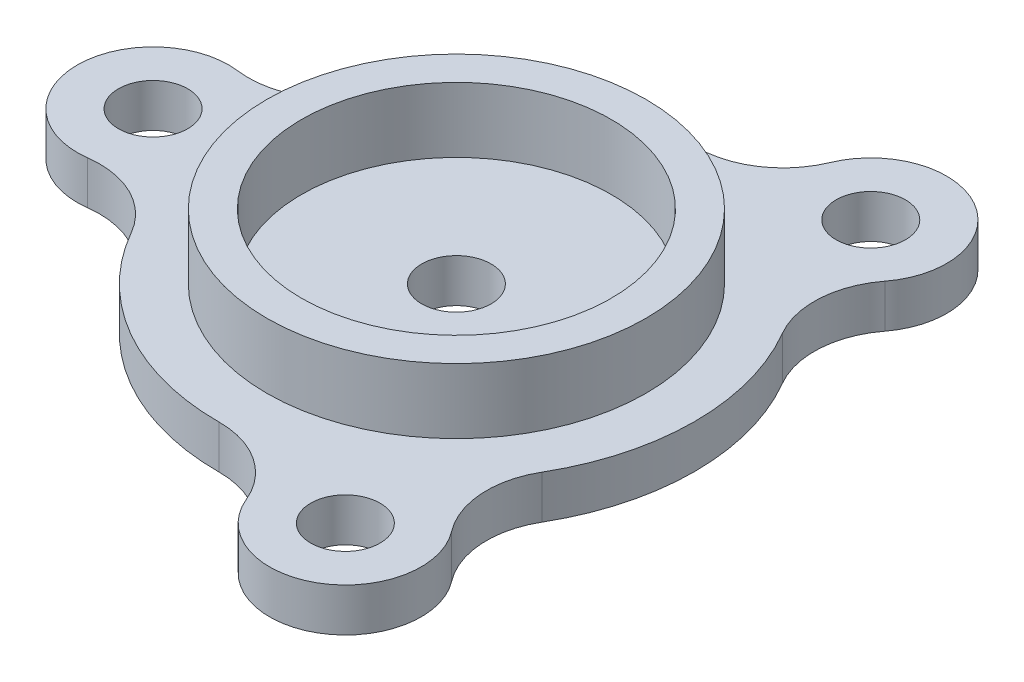
from build123d import *

# Parameters (mm, degrees)
SKETCH_1_R          = 11
EXTRUDE_1_DEPTH     = 2
EXTRUDE_START       = -2
SKETCH_2_R          = 1.6
EXTRUDE_2_DEPTH     = 2
CUT_EXTRUDE_1_REACH = 25.545
SKETCH_3_R          = 1.6
SKETCH_4_R          = 8.75
SKETCH_4_R_2        = 7.15
EXTRUDE_3_DEPTH     = 3


with BuildPart() as part:
    # 草图1 → 凸台-拉伸1 (new body)
    with BuildSketch(Plane(origin=(0, 0, 0), x_dir=(1, 0, 0), z_dir=(0, 1, 0))):
        with Locations(Location((0, 0, 0), (0, 0, 270))):
            Circle(SKETCH_1_R)
    extrude(amount=EXTRUDE_1_DEPTH)

    # 草图2 → 凸台-拉伸2 (add)
    # profile 1 of 3: a face of its own
    with BuildSketch(Plane(origin=(0, 2, 0), x_dir=(1, 0, 0), z_dir=(0, 1, 0)).offset(EXTRUDE_START)):
        with BuildLine():
            ThreePointArc((0.053619854, -10.999869313), (5.5, -9.526279442), (9.499356337, -5.546370812))
            ThreePointArc((9.499356337, -5.546370812), (8.961509488, -7.8135778), (9.778378275, -9.995831713))
            ThreePointArc((9.778378275, -9.995831713), (8.75, -15.155444566), (3.767455058, -13.466239851))
            ThreePointArc((3.767455058, -13.466239851), (2.286002125, -11.667683773), (0.053619854, -10.999869313))
        make_face()
        with Locations(Location((7, -12.124355653, 0), (0, 0, 270))):
            Circle(SKETCH_2_R, mode=Mode.SUBTRACT)
    # profile 2 of 3: a face of its own
    with BuildSketch(Plane(origin=(0, 2, 0), x_dir=(1, 0, 0), z_dir=(0, 1, 0)).offset(EXTRUDE_START)):
        with BuildLine():
            ThreePointArc((9.499356337, 5.546370812), (5.5, 9.526279442), (0.053619854, 10.999869313))
            ThreePointArc((0.053619854, 10.999869313), (2.286002125, 11.667683773), (3.767455058, 13.466239851))
            ThreePointArc((3.767455058, 13.466239851), (8.75, 15.155444566), (9.778378275, 9.995831713))
            ThreePointArc((9.778378275, 9.995831713), (8.961509488, 7.8135778), (9.499356337, 5.546370812))
        make_face()
        with Locations(Location((7, 12.124355653, 0), (0, 0, 270))):
            Circle(SKETCH_2_R, mode=Mode.SUBTRACT)
    # profile 3 of 3: a face of its own
    with BuildSketch(Plane(origin=(0, 2, 0), x_dir=(1, 0, 0), z_dir=(0, 1, 0)).offset(EXTRUDE_START)):
        with BuildLine():
            ThreePointArc((-9.55297619, -5.453498501), (-11.247511613, -3.854105973), (-13.545833333, -3.470408137))
            ThreePointArc((-13.545833333, -3.470408137), (-17.5, 0), (-13.545833333, 3.470408137))
            ThreePointArc((-13.545833333, 3.470408137), (-11.247511613, 3.854105973), (-9.55297619, 5.453498501))
            ThreePointArc((-9.55297619, 5.453498501), (-11, 0), (-9.55297619, -5.453498501))
        make_face()
        with Locations(Location((-14, 0, 0), (0, 0, 270))):
            Circle(SKETCH_2_R, mode=Mode.SUBTRACT)
    extrude(amount=EXTRUDE_2_DEPTH)

    # 草图3 → 切除-拉伸1 (cut, up to next)
    with BuildSketch(Plane(origin=(0, 2, 0), x_dir=(1, 0, 0), z_dir=(0, 1, 0)), mode=Mode.PRIVATE) as cut_extrude_1_sk1:
        with Locations(Location((0, 0, 0), (0, 0, 270))):
            Circle(SKETCH_3_R)
    cut_extrude_1_tool1 = extrude(cut_extrude_1_sk1.sketch, amount=-CUT_EXTRUDE_1_REACH, mode=Mode.PRIVATE) & part.part
    add(cut_extrude_1_tool1.solids().sort_by_distance((0, 2, 0))[0], mode=Mode.SUBTRACT)

    # 草图4 → 凸台-拉伸3 (add)
    with BuildSketch(Plane(origin=(0, 2, 0), x_dir=(1, 0, 0), z_dir=(0, 1, 0))):
        with Locations(Location((0, 0, 0), (0, 0, 270))):
            Circle(SKETCH_4_R)
        with Locations(Location((0, 0, 0), (0, 0, 270))):
            Circle(SKETCH_4_R_2, mode=Mode.SUBTRACT)
    extrude(amount=EXTRUDE_3_DEPTH)


solid = part.part
